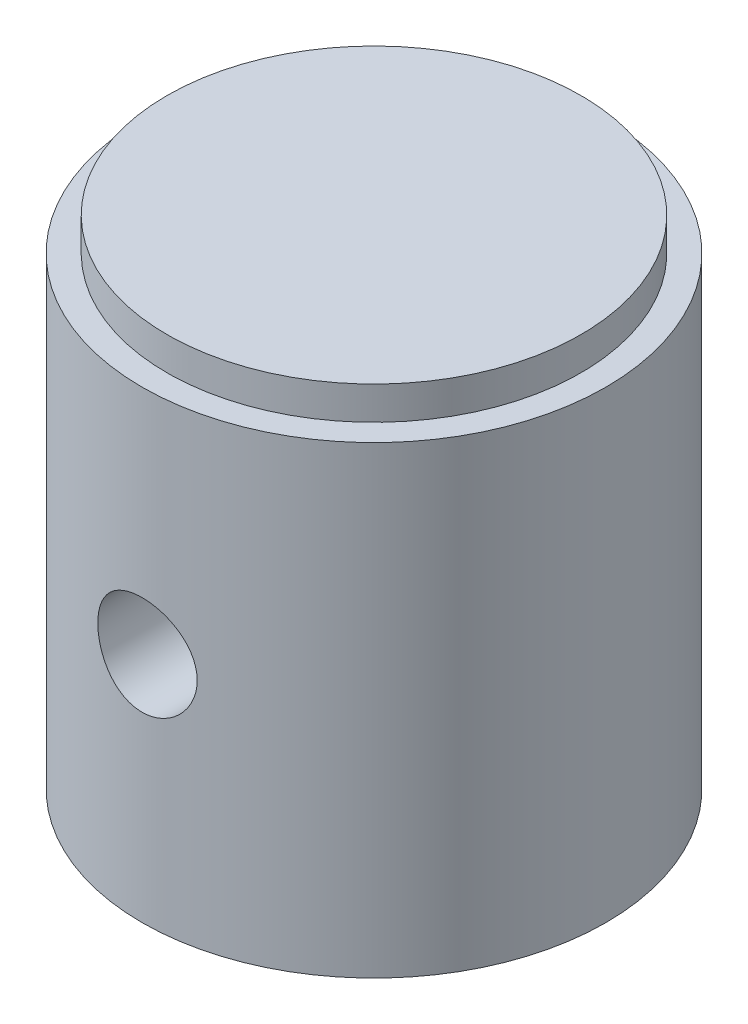
from build123d import *

# Parameters (mm, degrees)
CUT_EXTRUDE1_DEPTH      = 18.027499895
CUT_EXTRUDE1_DEPTH_BACK = 18.027499895
SKETCH2_R               = 1.5


with BuildPart() as part:
    # Sketch1 → Revolve1 (revolve)
    with BuildSketch(Plane.XY):
        Polygon((0, 1.14591206), (-6.25, 1.14591206), (-6.25, 0.14591206), (-7, 0.14591206), (-7, -13.85408794), (-6.25, -13.85408794), (-4.75, -9.732871811), (-4.75, -2.85408794), (0, 0), align=None)
    revolve(axis=Axis((0, 1.14591206, 0), (0, -1, 0)))

    # Sketch2 → Cut-Extrude1 (cut, two sides: drawn at the far end of the back side and taken through both)
    with BuildSketch(Plane.XY.offset(-CUT_EXTRUDE1_DEPTH_BACK)):
        with Locations((0, -6.85408794)):
            Circle(SKETCH2_R)
    extrude(amount=CUT_EXTRUDE1_DEPTH + CUT_EXTRUDE1_DEPTH_BACK, mode=Mode.SUBTRACT)


solid = part.part
